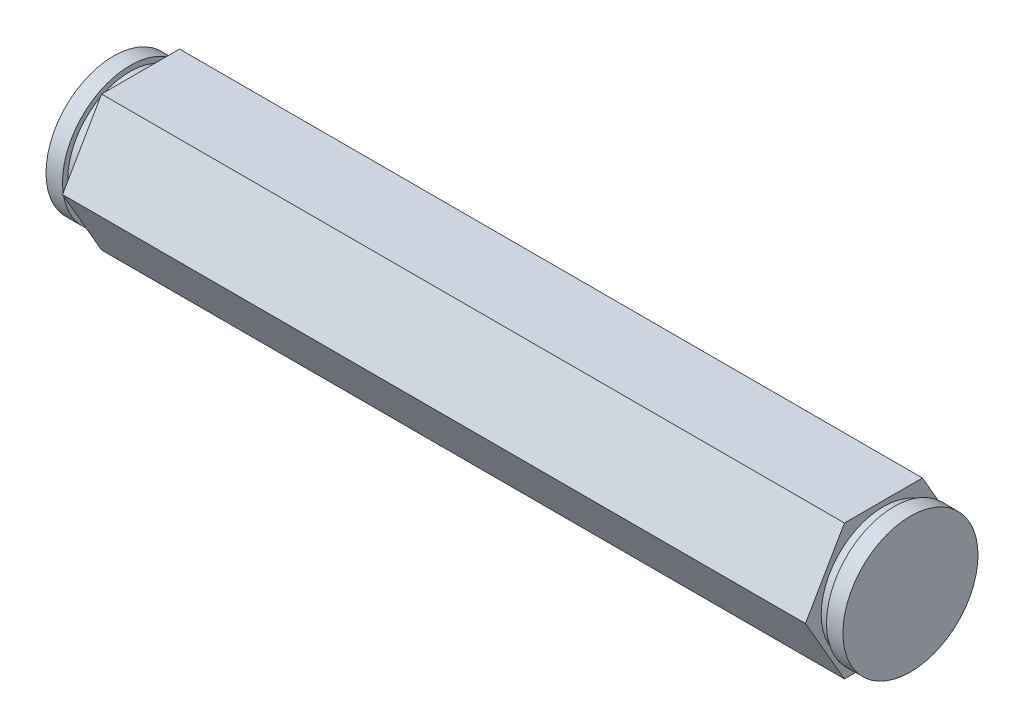
from build123d import *

# Parameters (mm, degrees)
BOSS_EXTRUDE1_DEPTH = 37.465


with BuildPart() as part:
    # Sketch1 → Boss-Extrude1 (new, symmetric)
    with BuildSketch(Plane(origin=(0, 0, 0), x_dir=(0, 0, -1), z_dir=(1, 0, 0))):
        Polygon((7.332348419, 0), (3.666174209, 6.35), (-3.666174209, 6.35), (-7.332348419, 0), (-3.666174209, -6.35), (3.666174209, -6.35), align=None)
    extrude(amount=BOSS_EXTRUDE1_DEPTH, both=True)

    # Sketch2 → Cut-Revolve1 (revolve, cut)
    with BuildSketch(Plane(origin=(0, 0, 0), x_dir=(1, 0, 0), z_dir=(0, 1, 0))):
        Polygon((34.925, -5.8547), (35.9156, -5.8547), (35.9156, -6.35), (37.465, -6.35), (37.465, -8.89), (34.925, -8.89), align=None)
    cut_revolve1 = revolve(axis=Axis((0, 0, 0), (1, 0, 0)), mode=Mode.SUBTRACT)

    # Mirror1: Cut-Revolve1 across plane
    add(cut_revolve1.mirror(Plane(origin=(0, 0, 0), x_dir=(0, 0, 1), z_dir=(1, 0, 0))), mode=Mode.SUBTRACT)


solid = part.part
